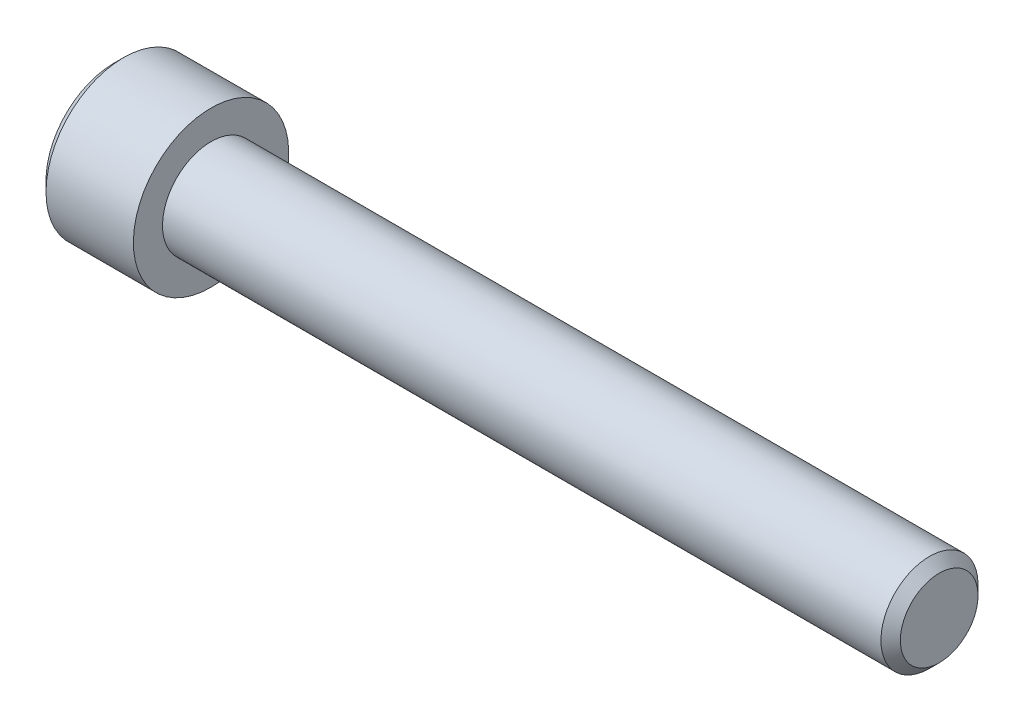
from build123d import *

# Parameters (mm, degrees)
CUT_EXTRUDE1_DEPTH = 5
CHAMFER1_SIZE      = 1


with BuildPart() as part:
    # Sketch1 → Revolve1 (revolve)
    with BuildSketch(Plane.XY, mode=Mode.PRIVATE) as revolve1_sk:
        Polygon((-10, 0), (-10, 8), (0, 8), (0, 5), (75, 5), (75, 0), align=None)
    revolve(revolve1_sk.sketch.rotate(Axis((75, 0, 0), (-1, 0, 0)), 180), axis=Axis((75, 0, 0), (-1, 0, 0)))

    # Sketch2 → Cut-Revolve1 (revolve, cut)
    with BuildSketch(Plane.XY, mode=Mode.PRIVATE) as cut_revolve1_sk:
        Polygon((-10, 0), (-10, 3.995), (-5, 3.995), (-3.929542976, 0), align=None)
    revolve(cut_revolve1_sk.sketch.rotate(Axis((-3.929542976, 0, 0), (-1, 0, 0)), 180), axis=Axis((-3.929542976, 0, 0), (-1, 0, 0)), mode=Mode.SUBTRACT)

    # Sketch3 → Cut-Extrude1 (cut)
    with BuildSketch(Plane(origin=(-10, 0, 0), x_dir=(0, 0, -1), z_dir=(1, 0, 0))):
        Polygon((0, 4.618802154), (-4, 2.309401077), (-4, -2.309401077), (0, -4.618802154), (4, -2.309401077), (4, 2.309401077), align=None)
    extrude(amount=CUT_EXTRUDE1_DEPTH, mode=Mode.SUBTRACT)

    # Chamfer1
    chamfer1_edges = [part.edges().sort_by_distance(p)[0] for p in [
        (75, 5, 0),
        (-10, 8, 0),
    ]]
    chamfer(chamfer1_edges, length=CHAMFER1_SIZE)


solid = part.part
